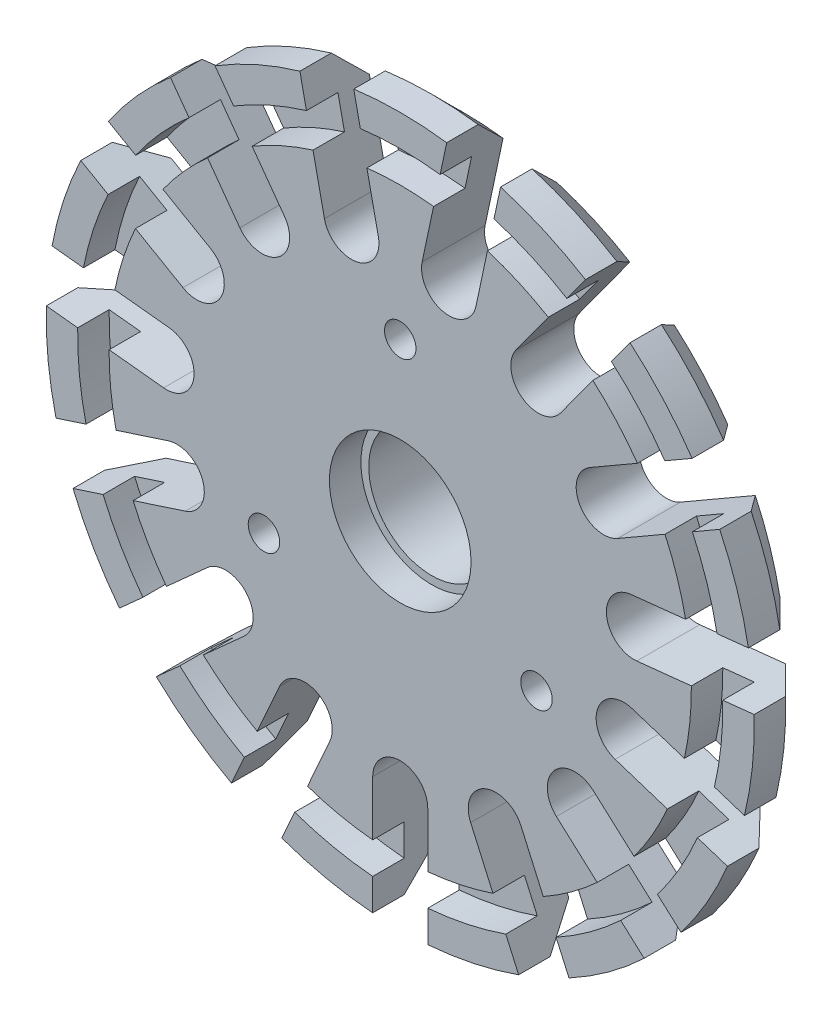
from build123d import *

# Parameters (mm, degrees)
RESSALTO_EXTRUS_O1_DEPTH                             = 4
ESBO_O2_R                                            = 4
CORTE_EXTRUS_O1_DEPTH                                = 11.823420621
ESBO_O4_R                                            = 22.5
RESSALTO_EXTRUS_O2_DEPTH                             = 4
CHANFRO1_SIZE                                        = 2
CORTE_EXTRUS_O2_DEPTH                                = 4
PADR_OCIRCULAR1_COUNT                                = 15
ESBO_O7_R                                            = 4.5
CORTE_EXTRUS_O3_DEPTH                                = 2
ESBO_O8_R                                            = 4
CORTE_EXTRUS_O4_DEPTH                                = 2
ESBO_O9_R                                            = 20.5
ESBO_O9_R_2                                          = 18.5
CORTE_EXTRUS_O5_DEPTH                                = 2
ESCAREADO_PARA_PARAFUSO_COM_CABE_A_ESCAR_D           = 2
ESCAREADO_PARA_PARAFUSO_COM_CABE_A_ESCAR_CSINK_D     = 3.6
ESCAREADO_PARA_PARAFUSO_COM_CABE_A_ESCAR_CSINK_ANGLE = 90
PADR_OCIRCULAR2_COUNT                                = 3


with BuildPart() as part:
    # Esboço1 → Ressalto-extrusão1 (new body)
    with BuildSketch(Plane.XY):
        with BuildLine():
            Line((-0.45, -5.983101203), (-0.45, -6.283101203))
            ThreePointArc((-0.45, -6.283101203), (-0.365922655, -6.733815462), (-0.125, -7.123903424))
            ThreePointArc((-0.125, -7.123903424), (0, -7.125), (0.125, -7.123903424))
            ThreePointArc((0.125, -7.123903424), (0.365922655, -6.733815462), (0.45, -6.283101203))
            Line((0.45, -6.283101203), (0.45, -5.983101203))
            ThreePointArc((0.45, -5.983101203), (0.62717078, -5.967131372), (0.803790267, -5.945916347))
            Line((0.803790267, -5.945916347), (0.866163774, -6.239360627))
            ThreePointArc((0.866163774, -6.239360627), (1.042112591, -6.662745036), (1.358874356, -6.994218004))
            ThreePointArc((1.358874356, -6.994218004), (1.481370797, -6.969301655), (1.603411256, -6.942240081))
            ThreePointArc((1.603411256, -6.942240081), (1.757965326, -6.51058584), (1.746496615, -6.052240106))
            Line((1.746496615, -6.052240106), (1.684123108, -5.758795825))
            ThreePointArc((1.684123108, -5.758795825), (1.854101966, -5.706339098), (2.022451042, -5.648866416))
            Line((2.022451042, -5.648866416), (2.144472035, -5.922930053))
            ThreePointArc((2.144472035, -5.922930053), (2.404602517, -6.300480681), (2.783359382, -6.558851694))
            ThreePointArc((2.783359382, -6.558851694), (2.897998582, -6.509011386), (3.011745747, -6.457167534))
            ThreePointArc((3.011745747, -6.457167534), (3.073176476, -6.002812376), (2.966662947, -5.556867074))
            Line((2.966662947, -5.556867074), (2.844641954, -5.282803437))
            ThreePointArc((2.844641954, -5.282803437), (3, -5.196152423), (3.152721002, -5.104933915))
            Line((3.152721002, -5.104933915), (3.329056578, -5.347639014))
            ThreePointArc((3.329056578, -5.347639014), (3.661999774, -5.662855086), (4.086198247, -5.836832093))
            ThreePointArc((4.086198247, -5.836832093), (4.187969923, -5.764246085), (4.288452496, -5.68988578))
            ThreePointArc((4.288452496, -5.68988578), (4.254075067, -5.232687206), (4.057171873, -4.818632287))
            Line((4.057171873, -4.818632287), (3.880836297, -4.575927188))
            ThreePointArc((3.880836297, -4.575927188), (4.014783638, -4.458868953), (4.145201926, -4.337891307))
            Line((4.145201926, -4.337891307), (4.368145374, -4.538630489))
            ThreePointArc((4.368145374, -4.538630489), (4.759350068, -4.777735551), (5.210450641, -4.859714921))
            ThreePointArc((5.210450641, -4.859714921), (5.294906882, -4.76755557), (5.377733293, -4.673928715))
            ThreePointArc((5.377733293, -4.673928715), (5.249050165, -4.233868496), (4.970362919, -3.869800146))
            Line((4.970362919, -3.869800146), (4.747419472, -3.669060964))
            ThreePointArc((4.747419472, -3.669060964), (4.854101966, -3.526711514), (4.956517635, -3.381262033))
            Line((4.956517635, -3.381262033), (5.216325256, -3.531262033))
            ThreePointArc((5.216325256, -3.531262033), (5.648693927, -3.683806047), (6.10698134, -3.670204888))
            ThreePointArc((6.10698134, -3.670204888), (6.170431002, -3.5625), (6.23198134, -3.453698537))
            ThreePointArc((6.23198134, -3.453698537), (6.014616583, -3.050009416), (5.666325256, -2.75183917))
            Line((5.666325256, -2.75183917), (5.406517635, -2.60183917))
            ThreePointArc((5.406517635, -2.60183917), (5.481272746, -2.440419858), (5.551209739, -2.276855383))
            Line((5.551209739, -2.276855383), (5.836526694, -2.369560481))
            ThreePointArc((5.836526694, -2.369560481), (6.291162756, -2.428876541), (6.736607649, -2.320289289))
            ThreePointArc((6.736607649, -2.320289289), (6.776277679, -2.201746085), (6.813861898, -2.08252516))
            ThreePointArc((6.813861898, -2.08252516), (6.517315394, -1.732850289), (6.114641989, -1.513609617))
            Line((6.114641989, -1.513609617), (5.829325034, -1.420904518))
            ThreePointArc((5.829325034, -1.420904518), (5.868885604, -1.247470145), (5.90328734, -1.072939227))
            Line((5.90328734, -1.072939227), (6.201643908, -1.104297766))
            ThreePointArc((6.201643908, -1.104297766), (6.658677584, -1.067793475), (7.071811878, -0.868965914))
            ThreePointArc((7.071811878, -0.868965914), (7.085968504, -0.744765301), (7.097943994, -0.62033544))
            ThreePointArc((7.097943994, -0.62033544), (6.73517625, -0.339957289), (6.295719525, -0.20922806))
            Line((6.295719525, -0.20922806), (5.997362957, -0.177869521))
            ThreePointArc((5.997362957, -0.177869521), (6, 0), (5.997362957, 0.177869521))
            Line((5.997362957, 0.177869521), (6.295719525, 0.20922806))
            ThreePointArc((6.295719525, 0.20922806), (6.73517625, 0.339957289), (7.097943994, 0.62033544))
            ThreePointArc((7.097943994, 0.62033544), (7.085968504, 0.744765301), (7.071811878, 0.868965914))
            ThreePointArc((7.071811878, 0.868965914), (6.658677584, 1.067793475), (6.201643908, 1.104297766))
            Line((6.201643908, 1.104297766), (5.90328734, 1.072939227))
            ThreePointArc((5.90328734, 1.072939227), (5.868885604, 1.247470145), (5.829325034, 1.420904518))
            Line((5.829325034, 1.420904518), (6.114641989, 1.513609617))
            ThreePointArc((6.114641989, 1.513609617), (6.517315394, 1.732850289), (6.813861898, 2.08252516))
            ThreePointArc((6.813861898, 2.08252516), (6.776277679, 2.201746085), (6.736607649, 2.320289289))
            ThreePointArc((6.736607649, 2.320289289), (6.291162756, 2.428876541), (5.836526694, 2.369560481))
            Line((5.836526694, 2.369560481), (5.551209739, 2.276855383))
            ThreePointArc((5.551209739, 2.276855383), (5.481272746, 2.440419858), (5.406517635, 2.60183917))
            Line((5.406517635, 2.60183917), (5.666325256, 2.75183917))
            ThreePointArc((5.666325256, 2.75183917), (6.014616583, 3.050009416), (6.23198134, 3.453698537))
            ThreePointArc((6.23198134, 3.453698537), (6.170431002, 3.5625), (6.10698134, 3.670204888))
            ThreePointArc((6.10698134, 3.670204888), (5.648693927, 3.683806047), (5.216325256, 3.531262033))
            Line((5.216325256, 3.531262033), (4.956517635, 3.381262033))
            ThreePointArc((4.956517635, 3.381262033), (4.854101966, 3.526711514), (4.747419472, 3.669060964))
            Line((4.747419472, 3.669060964), (4.970362919, 3.869800146))
            ThreePointArc((4.970362919, 3.869800146), (5.249050165, 4.233868496), (5.377733293, 4.673928715))
            ThreePointArc((5.377733293, 4.673928715), (5.294906882, 4.76755557), (5.210450641, 4.859714921))
            ThreePointArc((5.210450641, 4.859714921), (4.759350068, 4.777735551), (4.368145374, 4.538630489))
            Line((4.368145374, 4.538630489), (4.145201926, 4.337891307))
            ThreePointArc((4.145201926, 4.337891307), (4.014783638, 4.458868953), (3.880836297, 4.575927188))
            Line((3.880836297, 4.575927188), (4.057171873, 4.818632287))
            ThreePointArc((4.057171873, 4.818632287), (4.254075067, 5.232687206), (4.288452496, 5.68988578))
            ThreePointArc((4.288452496, 5.68988578), (4.187969923, 5.764246085), (4.086198247, 5.836832093))
            ThreePointArc((4.086198247, 5.836832093), (3.661999774, 5.662855086), (3.329056578, 5.347639014))
            Line((3.329056578, 5.347639014), (3.152721002, 5.104933915))
            ThreePointArc((3.152721002, 5.104933915), (3, 5.196152423), (2.844641954, 5.282803437))
            Line((2.844641954, 5.282803437), (2.966662947, 5.556867074))
            ThreePointArc((2.966662947, 5.556867074), (3.073176476, 6.002812376), (3.011745747, 6.457167534))
            ThreePointArc((3.011745747, 6.457167534), (2.897998582, 6.509011386), (2.783359382, 6.558851694))
            ThreePointArc((2.783359382, 6.558851694), (2.404602517, 6.300480681), (2.144472035, 5.922930053))
            Line((2.144472035, 5.922930053), (2.022451042, 5.648866416))
            ThreePointArc((2.022451042, 5.648866416), (1.854101966, 5.706339098), (1.684123108, 5.758795825))
            Line((1.684123108, 5.758795825), (1.746496615, 6.052240106))
            ThreePointArc((1.746496615, 6.052240106), (1.757965326, 6.51058584), (1.603411256, 6.942240081))
            ThreePointArc((1.603411256, 6.942240081), (1.481370797, 6.969301655), (1.358874356, 6.994218004))
            ThreePointArc((1.358874356, 6.994218004), (1.042112591, 6.662745036), (0.866163774, 6.239360627))
            Line((0.866163774, 6.239360627), (0.803790267, 5.945916347))
            ThreePointArc((0.803790267, 5.945916347), (0.62717078, 5.967131372), (0.45, 5.983101203))
            Line((0.45, 5.983101203), (0.45, 6.283101203))
            ThreePointArc((0.45, 6.283101203), (0.365922655, 6.733815462), (0.125, 7.123903424))
            ThreePointArc((0.125, 7.123903424), (0, 7.125), (-0.125, 7.123903424))
            ThreePointArc((-0.125, 7.123903424), (-0.365922655, 6.733815462), (-0.45, 6.283101203))
            Line((-0.45, 6.283101203), (-0.45, 5.983101203))
            ThreePointArc((-0.45, 5.983101203), (-0.62717078, 5.967131372), (-0.803790267, 5.945916347))
            Line((-0.803790267, 5.945916347), (-0.866163774, 6.239360627))
            ThreePointArc((-0.866163774, 6.239360627), (-1.042112591, 6.662745036), (-1.358874356, 6.994218004))
            ThreePointArc((-1.358874356, 6.994218004), (-1.481370797, 6.969301655), (-1.603411256, 6.942240081))
            ThreePointArc((-1.603411256, 6.942240081), (-1.757965326, 6.51058584), (-1.746496615, 6.052240106))
            Line((-1.746496615, 6.052240106), (-1.684123108, 5.758795825))
            ThreePointArc((-1.684123108, 5.758795825), (-1.854101966, 5.706339098), (-2.022451042, 5.648866416))
            Line((-2.022451042, 5.648866416), (-2.144472035, 5.922930053))
            ThreePointArc((-2.144472035, 5.922930053), (-2.404602517, 6.300480681), (-2.783359382, 6.558851694))
            ThreePointArc((-2.783359382, 6.558851694), (-2.897998582, 6.509011386), (-3.011745747, 6.457167534))
            ThreePointArc((-3.011745747, 6.457167534), (-3.073176476, 6.002812376), (-2.966662947, 5.556867074))
            Line((-2.966662947, 5.556867074), (-2.844641954, 5.282803437))
            ThreePointArc((-2.844641954, 5.282803437), (-3, 5.196152423), (-3.152721002, 5.104933915))
            Line((-3.152721002, 5.104933915), (-3.329056578, 5.347639014))
            ThreePointArc((-3.329056578, 5.347639014), (-3.661999774, 5.662855086), (-4.086198247, 5.836832093))
            ThreePointArc((-4.086198247, 5.836832093), (-4.187969923, 5.764246085), (-4.288452496, 5.68988578))
            ThreePointArc((-4.288452496, 5.68988578), (-4.254075067, 5.232687206), (-4.057171873, 4.818632287))
            Line((-4.057171873, 4.818632287), (-3.880836297, 4.575927188))
            ThreePointArc((-3.880836297, 4.575927188), (-4.014783638, 4.458868953), (-4.145201926, 4.337891307))
            Line((-4.145201926, 4.337891307), (-4.368145374, 4.538630489))
            ThreePointArc((-4.368145374, 4.538630489), (-4.759350068, 4.777735551), (-5.210450641, 4.859714921))
            ThreePointArc((-5.210450641, 4.859714921), (-5.294906882, 4.76755557), (-5.377733293, 4.673928715))
            ThreePointArc((-5.377733293, 4.673928715), (-5.249050165, 4.233868496), (-4.970362919, 3.869800146))
            Line((-4.970362919, 3.869800146), (-4.747419472, 3.669060964))
            ThreePointArc((-4.747419472, 3.669060964), (-4.854101966, 3.526711514), (-4.956517635, 3.381262033))
            Line((-4.956517635, 3.381262033), (-5.216325256, 3.531262033))
            ThreePointArc((-5.216325256, 3.531262033), (-5.648693927, 3.683806047), (-6.10698134, 3.670204888))
            ThreePointArc((-6.10698134, 3.670204888), (-6.170431002, 3.5625), (-6.23198134, 3.453698537))
            ThreePointArc((-6.23198134, 3.453698537), (-6.014616583, 3.050009416), (-5.666325256, 2.75183917))
            Line((-5.666325256, 2.75183917), (-5.406517635, 2.60183917))
            ThreePointArc((-5.406517635, 2.60183917), (-5.481272746, 2.440419858), (-5.551209739, 2.276855383))
            Line((-5.551209739, 2.276855383), (-5.836526694, 2.369560481))
            ThreePointArc((-5.836526694, 2.369560481), (-6.291162756, 2.428876541), (-6.736607649, 2.320289289))
            ThreePointArc((-6.736607649, 2.320289289), (-6.776277679, 2.201746085), (-6.813861898, 2.08252516))
            ThreePointArc((-6.813861898, 2.08252516), (-6.517315394, 1.732850289), (-6.114641989, 1.513609617))
            Line((-6.114641989, 1.513609617), (-5.829325034, 1.420904518))
            ThreePointArc((-5.829325034, 1.420904518), (-5.868885604, 1.247470145), (-5.90328734, 1.072939227))
            Line((-5.90328734, 1.072939227), (-6.201643908, 1.104297766))
            ThreePointArc((-6.201643908, 1.104297766), (-6.658677584, 1.067793475), (-7.071811878, 0.868965914))
            ThreePointArc((-7.071811878, 0.868965914), (-7.085968504, 0.744765301), (-7.097943994, 0.62033544))
            ThreePointArc((-7.097943994, 0.62033544), (-6.73517625, 0.339957289), (-6.295719525, 0.20922806))
            Line((-6.295719525, 0.20922806), (-5.997362957, 0.177869521))
            ThreePointArc((-5.997362957, 0.177869521), (-6, 0), (-5.997362957, -0.177869521))
            Line((-5.997362957, -0.177869521), (-6.295719525, -0.20922806))
            ThreePointArc((-6.295719525, -0.20922806), (-6.73517625, -0.339957289), (-7.097943994, -0.62033544))
            ThreePointArc((-7.097943994, -0.62033544), (-7.085968504, -0.744765301), (-7.071811878, -0.868965914))
            ThreePointArc((-7.071811878, -0.868965914), (-6.658677584, -1.067793475), (-6.201643908, -1.104297766))
            Line((-6.201643908, -1.104297766), (-5.90328734, -1.072939227))
            ThreePointArc((-5.90328734, -1.072939227), (-5.868885604, -1.247470145), (-5.829325034, -1.420904518))
            Line((-5.829325034, -1.420904518), (-6.114641989, -1.513609617))
            ThreePointArc((-6.114641989, -1.513609617), (-6.517315394, -1.732850289), (-6.813861898, -2.08252516))
            ThreePointArc((-6.813861898, -2.08252516), (-6.776277679, -2.201746085), (-6.736607649, -2.320289289))
            ThreePointArc((-6.736607649, -2.320289289), (-6.291162756, -2.428876541), (-5.836526694, -2.369560481))
            Line((-5.836526694, -2.369560481), (-5.551209739, -2.276855383))
            ThreePointArc((-5.551209739, -2.276855383), (-5.481272746, -2.440419858), (-5.406517635, -2.60183917))
            Line((-5.406517635, -2.60183917), (-5.666325256, -2.75183917))
            ThreePointArc((-5.666325256, -2.75183917), (-6.014616583, -3.050009416), (-6.23198134, -3.453698537))
            ThreePointArc((-6.23198134, -3.453698537), (-6.170431002, -3.5625), (-6.10698134, -3.670204888))
            ThreePointArc((-6.10698134, -3.670204888), (-5.648693927, -3.683806047), (-5.216325256, -3.531262033))
            Line((-5.216325256, -3.531262033), (-4.956517635, -3.381262033))
            ThreePointArc((-4.956517635, -3.381262033), (-4.854101966, -3.526711514), (-4.747419472, -3.669060964))
            Line((-4.747419472, -3.669060964), (-4.970362919, -3.869800146))
            ThreePointArc((-4.970362919, -3.869800146), (-5.249050165, -4.233868496), (-5.377733293, -4.673928715))
            ThreePointArc((-5.377733293, -4.673928715), (-5.294906882, -4.76755557), (-5.210450641, -4.859714921))
            ThreePointArc((-5.210450641, -4.859714921), (-4.759350068, -4.777735551), (-4.368145374, -4.538630489))
            Line((-4.368145374, -4.538630489), (-4.145201926, -4.337891307))
            ThreePointArc((-4.145201926, -4.337891307), (-4.014783638, -4.458868953), (-3.880836297, -4.575927188))
            Line((-3.880836297, -4.575927188), (-4.057171873, -4.818632287))
            ThreePointArc((-4.057171873, -4.818632287), (-4.254075067, -5.232687206), (-4.288452496, -5.68988578))
            ThreePointArc((-4.288452496, -5.68988578), (-4.187969923, -5.764246085), (-4.086198247, -5.836832093))
            ThreePointArc((-4.086198247, -5.836832093), (-3.661999774, -5.662855086), (-3.329056578, -5.347639014))
            Line((-3.329056578, -5.347639014), (-3.152721002, -5.104933915))
            ThreePointArc((-3.152721002, -5.104933915), (-3, -5.196152423), (-2.844641954, -5.282803437))
            Line((-2.844641954, -5.282803437), (-2.966662947, -5.556867074))
            ThreePointArc((-2.966662947, -5.556867074), (-3.073176476, -6.002812376), (-3.011745747, -6.457167534))
            ThreePointArc((-3.011745747, -6.457167534), (-2.897998582, -6.509011386), (-2.783359382, -6.558851694))
            ThreePointArc((-2.783359382, -6.558851694), (-2.404602517, -6.300480681), (-2.144472035, -5.922930053))
            Line((-2.144472035, -5.922930053), (-2.022451042, -5.648866416))
            ThreePointArc((-2.022451042, -5.648866416), (-1.854101966, -5.706339098), (-1.684123108, -5.758795825))
            Line((-1.684123108, -5.758795825), (-1.746496615, -6.052240106))
            ThreePointArc((-1.746496615, -6.052240106), (-1.757965326, -6.51058584), (-1.603411256, -6.942240081))
            ThreePointArc((-1.603411256, -6.942240081), (-1.481370797, -6.969301655), (-1.358874356, -6.994218004))
            ThreePointArc((-1.358874356, -6.994218004), (-1.042112591, -6.662745036), (-0.866163774, -6.239360627))
            Line((-0.866163774, -6.239360627), (-0.803790267, -5.945916347))
            ThreePointArc((-0.803790267, -5.945916347), (-0.62717078, -5.967131372), (-0.45, -5.983101203))
        make_face()
    extrude(amount=RESSALTO_EXTRUS_O1_DEPTH)

    # Esboço2 → Corte-extrusão1 (cut, through all)
    with BuildSketch(Plane.XY.offset(4)):
        Circle(ESBO_O2_R)
    extrude(amount=-CORTE_EXTRUS_O1_DEPTH, mode=Mode.SUBTRACT)

    # Esboço4 → Ressalto-extrusão2 (add)
    with BuildSketch(Plane.XY.offset(4)):
        Circle(ESBO_O4_R)
    extrude(amount=RESSALTO_EXTRUS_O2_DEPTH)

    # Chanfro1
    chanfro1_edges = [part.edges().sort_by_distance(p)[0] for p in [
        (-22.5, 0, 4),
    ]]
    chamfer(chanfro1_edges, length=CHANFRO1_SIZE)

    # Esboço5 → Corte-extrusão2 (cut)
    with BuildSketch(Plane.XY.offset(8)):
        with BuildLine():
            Line((-1.75, -22.431841208), (-1.75, -14.931841208))
            ThreePointArc((-1.75, -14.931841208), (0, -13.181841208), (1.75, -14.931841208))
            Line((1.75, -14.931841208), (1.75, -22.431841208))
            Line((1.75, -22.431841208), (1.75, -22.831841208))
            Line((1.75, -22.831841208), (-1.75, -22.831841208))
            Line((-1.75, -22.831841208), (-1.75, -22.431841208))
        make_face()
    corte_extrus_o2 = extrude(amount=-CORTE_EXTRUS_O2_DEPTH, mode=Mode.SUBTRACT)

    # PadrãoCircular1: Corte-extrusão2 ×15 about axis
    padr_ocircular1_axis = Axis((0, 0, 0), (0, 0, 1))
    for i in range(1, PADR_OCIRCULAR1_COUNT):
        add(corte_extrus_o2.rotate(padr_ocircular1_axis, i * 360 / PADR_OCIRCULAR1_COUNT), mode=Mode.SUBTRACT)

    # Esboço7 → Corte-extrusão3 (cut)
    with BuildSketch(Plane.XY.offset(8)):
        Circle(ESBO_O7_R)
    extrude(amount=-CORTE_EXTRUS_O3_DEPTH, mode=Mode.SUBTRACT)

    # Esboço8 → Corte-extrusão4 (cut)
    with BuildSketch(Plane.XY.offset(6)):
        Circle(ESBO_O8_R)
    extrude(amount=-CORTE_EXTRUS_O4_DEPTH, mode=Mode.SUBTRACT)

    # Esboço9 → Corte-extrusão5 (cut)
    with BuildSketch(Plane.XY.offset(8)):
        Circle(ESBO_O9_R)
        Circle(ESBO_O9_R_2, mode=Mode.SUBTRACT)
    extrude(amount=-CORTE_EXTRUS_O5_DEPTH, mode=Mode.SUBTRACT)

    # Escareado para parafuso com cabeça escareada chata de M1.61 (through all)
    with Locations(Plane(origin=(0, 10, 4), x_dir=(-1, 0, 0), z_dir=(0, 0, -1))):
        with Locations((0, 0)):
            escareado_para_parafuso_com_cabe_a_escar = CounterSinkHole(ESCAREADO_PARA_PARAFUSO_COM_CABE_A_ESCAR_D / 2, ESCAREADO_PARA_PARAFUSO_COM_CABE_A_ESCAR_CSINK_D / 2, counter_sink_angle=ESCAREADO_PARA_PARAFUSO_COM_CABE_A_ESCAR_CSINK_ANGLE)

    # PadrãoCircular2: Escareado para parafuso com cabeça escareada chata de M1.61 ×3 about axis
    padr_ocircular2_axis = Axis((0, 0, 0), (0, 0, 1))
    for i in range(1, PADR_OCIRCULAR2_COUNT):
        add(escareado_para_parafuso_com_cabe_a_escar.rotate(padr_ocircular2_axis, i * 360 / PADR_OCIRCULAR2_COUNT), mode=Mode.SUBTRACT)


solid = part.part
